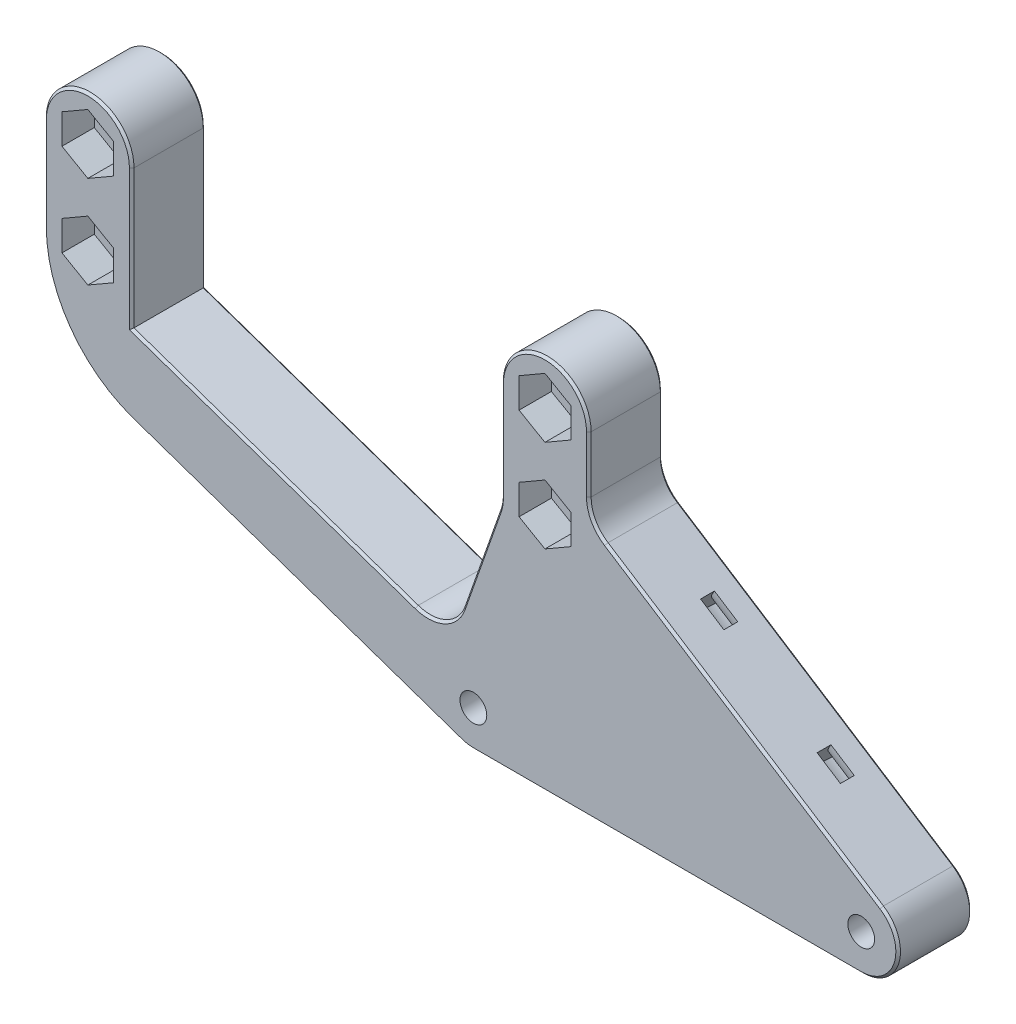
from build123d import *

# Parameters (mm, degrees)
SZKIC1_R                    = 1.55
SZKIC1_R_2                  = 1.45
DODANIE_WYCI_GNI_CIE1_DEPTH = 8
WYTNIJ_WYCI_GNI_CIE1_DEPTH  = 3
ZAOKR_GLENIE1_R             = 4
WYTNIJ_WYCI_GNI_CIE2_DEPTH  = 3.5
SFAZOWANIE1_SIZE            = 0.25
WYTNIJ_WYCI_GNI_CIE3_DEPTH  = 1
WYTNIJ_WYCI_GNI_CIE4_DEPTH  = 3
SZYK_LINIOWY1_COUNT         = 2
SZYK_LINIOWY1_PITCH         = 15


with BuildPart() as part:
    # Szkic1 → Dodanie-wyciągnięcie1 (new body)
    # profile 1 of 17: a face of its own
    with BuildSketch(Plane.XY):
        with BuildLine():
            Line((-30, -5), (-30, 5))
            ThreePointArc((-30, 5), (-34.75, 9.75), (-39.5, 5))
            Line((-39.5, 5), (-39.5, -5))
            ThreePointArc((-39.5, -5), (-34.75, -9.75), (-30, -5))
        make_face()
        with Locations((-34.75, -5)):
            Circle(SZKIC1_R, mode=Mode.SUBTRACT)
        with Locations((-34.75, 5)):
            Circle(SZKIC1_R, mode=Mode.SUBTRACT)
    # profile 2 of 17: a face of its own
    with BuildSketch(Plane.XY):
        with BuildLine():
            Line((-30, -10), (-30, -5))
            ThreePointArc((-30, -5), (-34.75, -9.75), (-39.5, -5))
            ThreePointArc((-39.5, -5), (-36.846817098, -13.293438899), (-29.872582883, -18.506937282))
            ThreePointArc((-29.872582883, -18.506937282), (-32.348896474, -13.420890585), (-27.262849777, -10.944576994))
            Line((-27.262849777, -10.944576994), (-30, -10))
        make_face()
    # profile 3 of 17: a face of its own
    with BuildSketch(Plane.XY):
        with BuildLine():
            Line((4.547807332, -21.922277315), (-27.262849777, -10.944576994))
            ThreePointArc((-27.262849777, -10.944576994), (-32.348896474, -13.420890585), (-29.872582883, -18.506937282))
            Line((-29.872582883, -18.506937282), (5.695133447, -30.781180144))
            ThreePointArc((5.695133447, -30.781180144), (3.398037408, -28.739501506), (3.227247846, -25.670962309))
            Line((3.227247846, -25.670962309), (4.547807332, -21.922277315))
        make_face()
    # profile 4 of 17: a face of its own
    with BuildSketch(Plane.XY):
        with BuildLine():
            Line((7.670780796, -23), (4.547807332, -21.922277315))
            Line((4.547807332, -21.922277315), (3.227247846, -25.670962309))
            ThreePointArc((3.227247846, -25.670962309), (4.688739604, -23.735329208), (7, -23))
            Line((7, -23), (7.670780796, -23))
        make_face()
    # profile 5 of 17: a face of its own
    with BuildSketch(Plane.XY):
        with BuildLine():
            Line((10, -6.445085227), (4.547807332, -21.922277315))
            Line((4.547807332, -21.922277315), (7.670780796, -23))
            Line((7.670780796, -23), (12.650026795, -23))
            Line((12.650026795, -23), (16.842670109, -11.098302851))
            Line((16.842670109, -11.098302851), (14.743601006, -9.74999569))
            ThreePointArc((14.743601006, -9.74999569), (11.798045524, -8.721352546), (10.126086359, -6.087162658))
            Line((10.126086359, -6.087162658), (10, -6.445085227))
        make_face()
    # profile 6 of 17: a face of its own
    with BuildSketch(Plane.XY):
        with BuildLine():
            ThreePointArc((3.227247846, -25.670962309), (3.398037408, -28.739501506), (5.695133447, -30.781180144))
            ThreePointArc((5.695133447, -30.781180144), (6.338456568, -30.944915752), (7, -31))
            ThreePointArc((7, -31), (9.311260396, -30.264670792), (10.772752154, -28.329037691))
            ThreePointArc((10.772752154, -28.329037691), (10.601962592, -25.260498494), (8.304866553, -23.218819856))
            Line((8.304866553, -23.218819856), (7.670780796, -23))
            Line((7.670780796, -23), (7, -23))
            ThreePointArc((7, -23), (4.688739604, -23.735329208), (3.227247846, -25.670962309))
        make_face()
        with Locations((7, -27)):
            Circle(SZKIC1_R_2, mode=Mode.SUBTRACT)
    # profile 7 of 17: a face of its own
    with BuildSketch(Plane.XY):
        with BuildLine():
            Line((10, -5), (10, -6.445085227))
            Line((10, -6.445085227), (10.126086359, -6.087162658))
            ThreePointArc((10.126086359, -6.087162658), (10.03162688, -5.547224911), (10, -5))
        make_face()
    # profile 8 of 17: a face of its own
    with BuildSketch(Plane.XY):
        with BuildLine():
            Line((12.650026795, -23), (7.670780796, -23))
            Line((7.670780796, -23), (8.304866553, -23.218819856))
            ThreePointArc((8.304866553, -23.218819856), (10.601962592, -25.260498494), (10.772752154, -28.329037691))
            Line((10.772752154, -28.329037691), (12.650026795, -23))
        make_face()
    # profile 9 of 17: a face of its own
    with BuildSketch(Plane.XY):
        with BuildLine():
            ThreePointArc((10.772752154, -28.329037691), (9.311260396, -30.264670792), (7, -31))
            Line((7, -31), (49, -31))
            ThreePointArc((49, -31), (47.873511508, -30.838101572), (46.838211374, -30.365511839))
            Line((46.838211374, -30.365511839), (35.371448625, -23))
            Line((35.371448625, -23), (12.650026795, -23))
            Line((12.650026795, -23), (10.772752154, -28.329037691))
        make_face()
    # profile 10 of 17: a face of its own
    with BuildSketch(Plane.XY):
        with BuildLine():
            ThreePointArc((10, -5), (10.03162688, -5.547224911), (10.126086359, -6.087162658))
            Line((10.126086359, -6.087162658), (10.977247846, -3.670962309))
            ThreePointArc((10.977247846, -3.670962309), (13.45169048, -1.216563415), (16.911788626, -1.634488161))
            Line((16.911788626, -1.634488161), (19.5, -3.296988898))
            Line((19.5, -3.296988898), (19.5, 5))
            ThreePointArc((19.5, 5), (14.75, 9.75), (10, 5))
            Line((10, 5), (10, -5))
        make_face()
        with Locations((14.75, 5)):
            Circle(SZKIC1_R, mode=Mode.SUBTRACT)
    # profile 11 of 17: a face of its own
    with BuildSketch(Plane.XY):
        with BuildLine():
            Line((10.977247846, -3.670962309), (10.126086359, -6.087162658))
            ThreePointArc((10.126086359, -6.087162658), (11.798045524, -8.721352546), (14.743601006, -9.74999569))
            Line((14.743601006, -9.74999569), (12.588211374, -8.365511839))
            ThreePointArc((12.588211374, -8.365511839), (10.966563415, -6.29830952), (10.977247846, -3.670962309))
        make_face()
    # profile 12 of 17: a face of its own
    with BuildSketch(Plane.XY):
        Polygon((16.842670109, -11.098302851), (12.650026795, -23), (35.371448625, -23), align=None)
    # profile 13 of 17: a face of its own
    with BuildSketch(Plane.XY):
        with BuildLine():
            ThreePointArc((46.838211374, -30.365511839), (47.873511508, -30.838101572), (49, -31))
            ThreePointArc((49, -31), (52.838101572, -28.126488492), (51.161788626, -23.634488161))
            ThreePointArc((51.161788626, -23.634488161), (50.126488492, -23.161898428), (49, -23))
            Line((49, -23), (35.371448625, -23))
            Line((35.371448625, -23), (46.838211374, -30.365511839))
        make_face()
        with Locations((49, -27)):
            Circle(SZKIC1_R_2, mode=Mode.SUBTRACT)
    # profile 14 of 17: a face of its own
    with BuildSketch(Plane.XY):
        with BuildLine():
            ThreePointArc((16.911788626, -1.634488161), (13.45169048, -1.216563415), (10.977247846, -3.670962309))
            ThreePointArc((10.977247846, -3.670962309), (10.966563415, -6.29830952), (12.588211374, -8.365511839))
            Line((12.588211374, -8.365511839), (14.743601006, -9.74999569))
            ThreePointArc((14.743601006, -9.74999569), (16.291742556, -9.492830944), (17.671590668, -8.745238039))
            Line((17.671590668, -8.745238039), (18.522752154, -6.329037691))
            ThreePointArc((18.522752154, -6.329037691), (18.533436585, -3.70169048), (16.911788626, -1.634488161))
        make_face()
        with Locations((14.75, -5)):
            Circle(SZKIC1_R, mode=Mode.SUBTRACT)
    # profile 15 of 17: a face of its own
    with BuildSketch(Plane.XY):
        with BuildLine():
            ThreePointArc((17.671590668, -8.745238039), (16.291742556, -9.492830944), (14.743601006, -9.74999569))
            Line((14.743601006, -9.74999569), (16.842670109, -11.098302851))
            Line((16.842670109, -11.098302851), (17.671590668, -8.745238039))
        make_face()
    # profile 16 of 17: a face of its own
    with BuildSketch(Plane.XY):
        with BuildLine():
            Line((16.842670109, -11.098302851), (35.371448625, -23))
            Line((35.371448625, -23), (49, -23))
            ThreePointArc((49, -23), (50.126488492, -23.161898428), (51.161788626, -23.634488161))
            Line((51.161788626, -23.634488161), (19.5, -3.296988898))
            Line((19.5, -3.296988898), (19.5, -5))
            ThreePointArc((19.5, -5), (19.018492455, -7.083859919), (17.671590668, -8.745238039))
            Line((17.671590668, -8.745238039), (16.842670109, -11.098302851))
        make_face()
    # profile 17 of 17: a face of its own
    with BuildSketch(Plane.XY):
        with BuildLine():
            Line((19.5, -3.296988898), (16.911788626, -1.634488161))
            ThreePointArc((16.911788626, -1.634488161), (18.533436585, -3.70169048), (18.522752154, -6.329037691))
            Line((18.522752154, -6.329037691), (17.671590668, -8.745238039))
            ThreePointArc((17.671590668, -8.745238039), (19.018492455, -7.083859919), (19.5, -5))
            Line((19.5, -5), (19.5, -3.296988898))
        make_face()
    extrude(amount=DODANIE_WYCI_GNI_CIE1_DEPTH)

    # Szkic2 → Wytnij-wyciągnięcie1 (cut)
    with BuildSketch(Plane(origin=(0, 0, 0), x_dir=(-1, 0, 0), z_dir=(0, 0, -1))):
        Polygon((-45.766838493, -27), (-47.383419246, -24.2), (-50.616580754, -24.2), (-52.233161507, -27), (-50.616580754, -29.8), (-47.383419246, -29.8), align=None)
        Polygon((-10.233161507, -27), (-8.616580754, -29.8), (-5.383419246, -29.8), (-3.766838493, -27), (-5.383419246, -24.2), (-8.616580754, -24.2), align=None)
    extrude(amount=-WYTNIJ_WYCI_GNI_CIE1_DEPTH, mode=Mode.SUBTRACT)

    # Zaokrąglenie1
    zaokr_glenie1_edges = [part.edges().sort_by_distance(p)[0] for p in [
        (4.547807332, -21.922277315, 4),
        (10, -6.445085227, 4),
        (19.5, -3.296988898, 4),
    ]]
    fillet(zaokr_glenie1_edges, radius=ZAOKR_GLENIE1_R)

    # Szkic3 → Wytnij-wyciągnięcie2 (cut)
    with BuildSketch(Plane.XY.offset(8)):
        Polygon((-34.75, 1.766838493), (-31.95, 3.383419246), (-31.95, 6.616580754), (-34.75, 8.233161507), (-37.55, 6.616580754), (-37.55, 3.383419246), align=None)
        Polygon((-34.75, -8.233161507), (-31.95, -6.616580754), (-31.95, -3.383419246), (-34.75, -1.766838493), (-37.55, -3.383419246), (-37.55, -6.616580754), align=None)
        Polygon((14.75, 1.766838493), (17.55, 3.383419246), (17.55, 6.616580754), (14.75, 8.233161507), (11.95, 6.616580754), (11.95, 3.383419246), align=None)
        Polygon((14.75, -8.233161507), (17.55, -6.616580754), (17.55, -3.383419246), (14.75, -1.766838493), (11.95, -3.383419246), (11.95, -6.616580754), align=None)
    extrude(amount=-WYTNIJ_WYCI_GNI_CIE2_DEPTH, mode=Mode.SUBTRACT)

    # Sfazowanie1
    sfazowanie1_edges = [part.edges().sort_by_distance(p)[0] for p in [
        (36.25, -14.056112985, 8),
        (7.820559487, -12.631884103, 0),
        (7.820559487, -12.631884103, 8),
        (-14.604625944, -15.312867387, 0),
        (-14.604625944, -15.312867387, 8),
        (19.9895047, -3.029625968, 0),
        (19.9895047, -3.029625968, 8),
        (9.942778755, -6.435301151, 0),
        (9.942778755, -6.435301151, 8),
        (3.835116171, -20.446517222, 0),
        (3.835116171, -20.446517222, 8),
        (19.5, 1.943887015, 8),
        (14.75, 9.75, 8),
        (10, -0.380569097, 8),
        (52.838101572, -28.126488492, 0),
        (28, -31, 0),
        (6.338456568, -30.944915752, 0),
        (-12.088724718, -24.644058713, 0),
        (-36.846817098, -13.293438899, 0),
        (-39.5, 0, 0),
        (-34.75, 9.75, 0),
        (-30, -2.5, 0),
        (10, -0.380569097, 0),
        (14.75, 9.75, 0),
        (19.5, 1.943887015, 0),
        (36.25, -14.056112985, 0),
        (-30, -2.5, 8),
        (-34.75, 9.75, 8),
        (-39.5, 0, 8),
        (-36.846817098, -13.293438899, 8),
        (-12.088724718, -24.644058713, 8),
        (6.338456568, -30.944915752, 8),
        (28, -31, 8),
        (52.838101572, -28.126488492, 8),
    ]]
    chamfer(sfazowanie1_edges, length=SFAZOWANIE1_SIZE)

    # Szkic4 → Wytnij-wyciągnięcie3 (cut)
    with BuildSketch(Plane(origin=(0, 0, 0), x_dir=(-1, 0, 0), z_dir=(0, 0, -1))):
        Polygon((-40.766838493, -25.5), (-40.766838493, -28.5), (-37.058739249, -27), align=None)
    extrude(amount=-WYTNIJ_WYCI_GNI_CIE3_DEPTH, mode=Mode.SUBTRACT)

    # Szkic5 → Wytnij-wyciągnięcie4 (cut)
    with BuildSketch(Plane(origin=(42.74800903, -18.230016596, 0.25), x_dir=(0, 0, 1), z_dir=(-0.841377959640588, 0.5404471565574577, 0))):
        with BuildLine():
            Line((2.25, 0), (3.75, 0))
            ThreePointArc((3.75, 0), (2.578427125, -2.828427125), (-0.25, -4))
            Line((-0.25, -4), (-0.25, -2.5))
            ThreePointArc((-0.25, -2.5), (1.517766953, -1.767766953), (2.25, 0))
        make_face()
    wytnij_wyci_gni_cie4 = extrude(amount=WYTNIJ_WYCI_GNI_CIE4_DEPTH, mode=Mode.SUBTRACT)

    # Szyk liniowy1: Wytnij-wyciągnięcie4 ×2
    with Locations(*[Vector(-0.8413779596405879, 0.5404471565574578, 0) * (i * SZYK_LINIOWY1_PITCH) for i in range(1, SZYK_LINIOWY1_COUNT)]):
        add(wytnij_wyci_gni_cie4, mode=Mode.SUBTRACT)


solid = part.part
